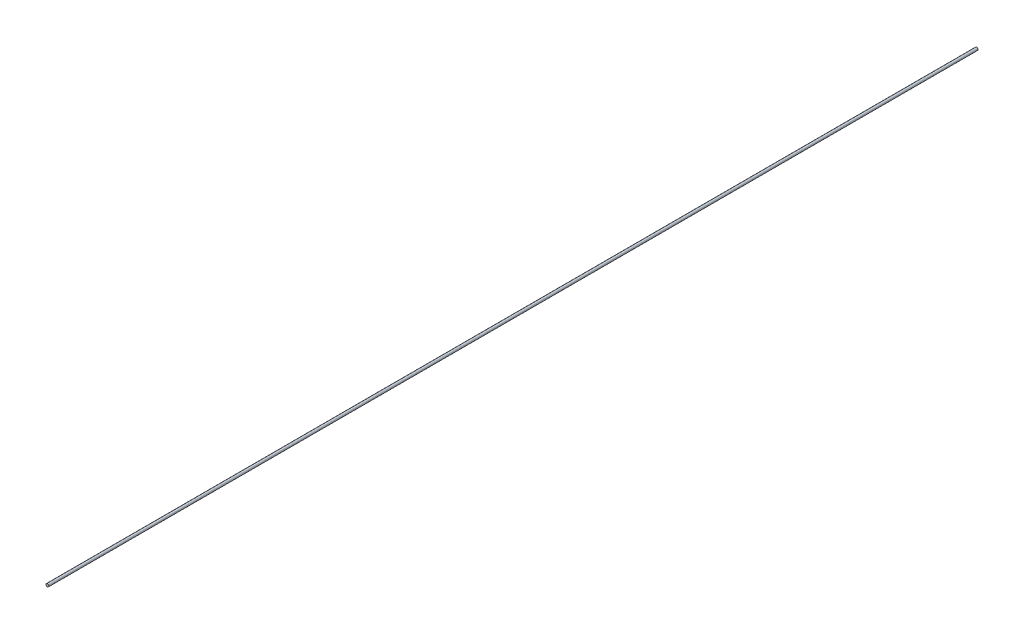
from build123d import *

# Parameters (mm, degrees)
ESBO_O1_R                = 5
RESSALTO_EXTRUS_O1_DEPTH = 1675


with BuildPart() as part:
    # Esboço1 → Ressalto-extrusão1 (new, symmetric)
    with BuildSketch(Plane.XY):
        with Locations(Location((0, 0, 0), (0, 0, 180))):
            Circle(ESBO_O1_R)
    extrude(amount=RESSALTO_EXTRUS_O1_DEPTH, both=True)


solid = part.part
